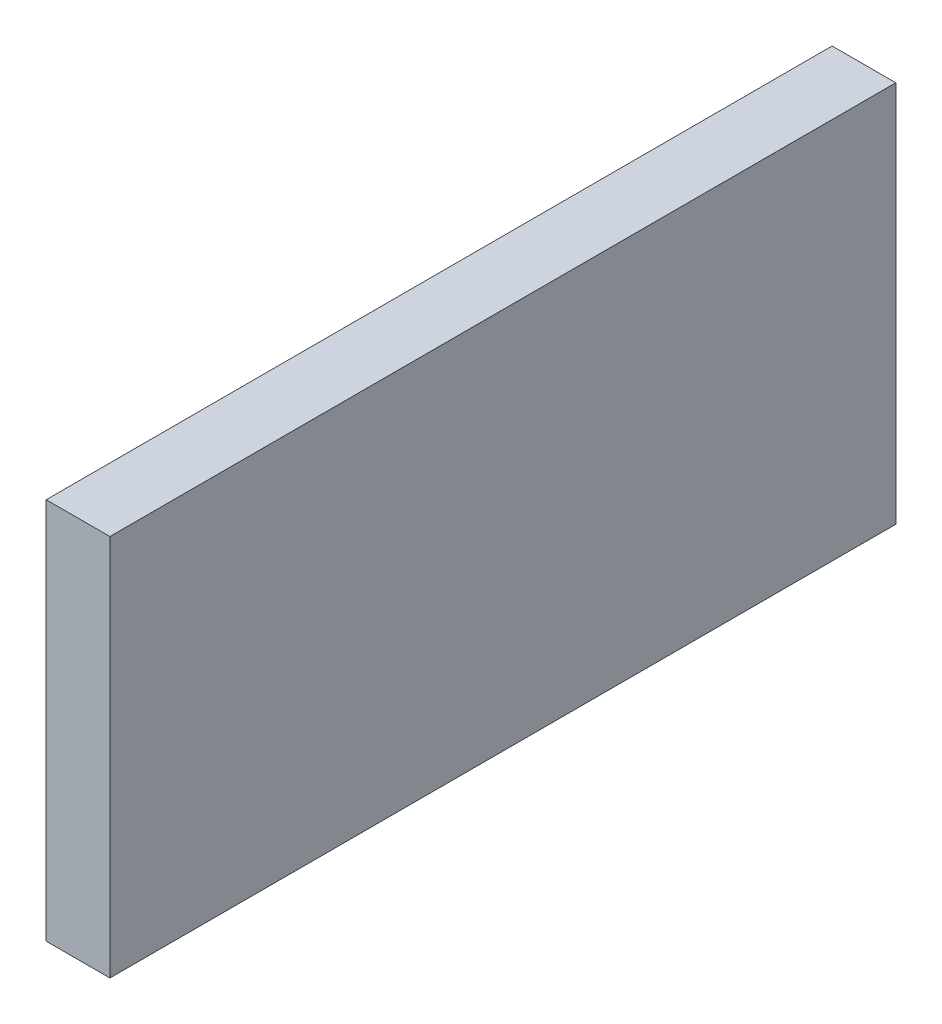
from build123d import *

# Parameters (mm, degrees)
SKETCH1_W           = 3
SKETCH1_H           = 37
BOSS_EXTRUDE1_DEPTH = 18


with BuildPart() as part:
    # Sketch1 → Boss-Extrude1 (new body)
    with BuildSketch(Plane(origin=(0, 0, 0), x_dir=(1, 0, 0), z_dir=(0, 1, 0))):
        with Locations((1.5, 18.5)):
            Rectangle(SKETCH1_W, SKETCH1_H)
    extrude(amount=BOSS_EXTRUDE1_DEPTH)


solid = part.part
